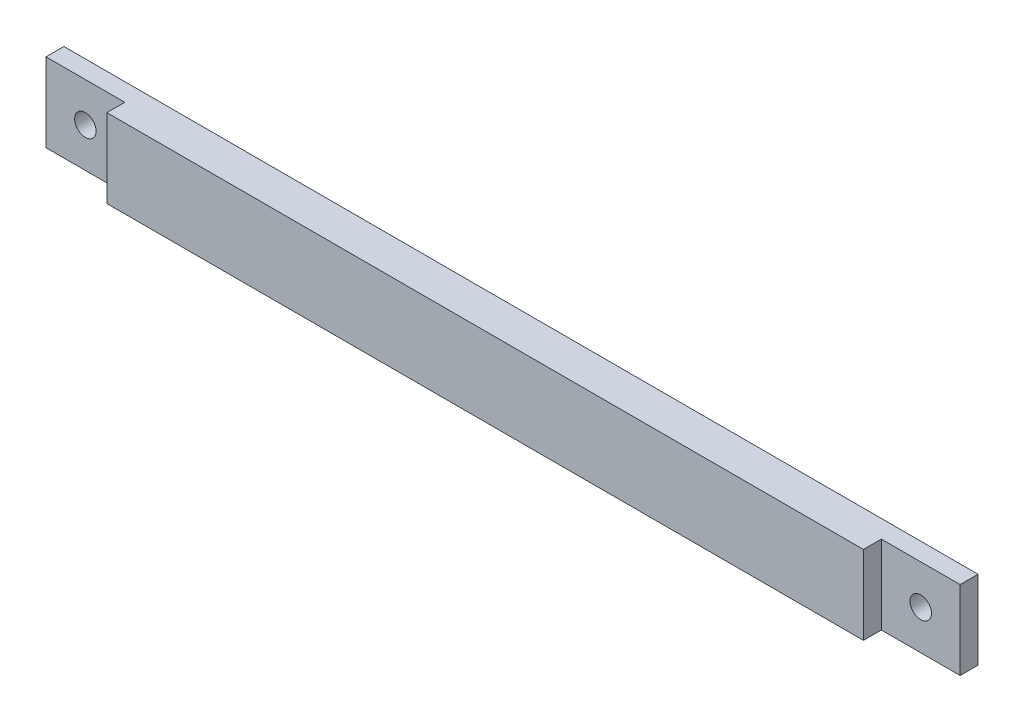
from build123d import *

# Parameters (mm, degrees)
ESQUISSE5_W             = 255.35
ESQUISSE5_H             = 22
BOSS_EXTRU_1_DEPTH      = 10
ESQUISSE6_R             = 3
ENL_V_MAT_EXTRU_4_DEPTH = 173.494473459
ESQUISSE7_W             = 22
ESQUISSE7_H             = 22
ENL_V_MAT_EXTRU_5_DEPTH = 5


with BuildPart() as part:
    # Esquisse5 → Boss.-Extru.1 (new body)
    with BuildSketch(Plane.XY):
        with Locations((41.235968465, 22.517579062)):
            Rectangle(ESQUISSE5_W, ESQUISSE5_H)
    extrude(amount=BOSS_EXTRU_1_DEPTH)

    # Esquisse6 → Enlèv. mat.-Extru.4 (cut, through all)
    with BuildSketch(Plane.XY):
        with Locations((-75.439031535, 22.517579062)):
            Circle(ESQUISSE6_R)
        with Locations((157.910968465, 22.517579062)):
            Circle(ESQUISSE6_R)
    extrude(amount=ENL_V_MAT_EXTRU_4_DEPTH, mode=Mode.SUBTRACT)

    # Esquisse7 → Enlèv. mat.-Extru.5 (cut)
    with BuildSketch(Plane.XY.offset(10)):
        with Locations((-75.439031535, 22.517579062)):
            Rectangle(ESQUISSE7_W, ESQUISSE7_H)
        with Locations((157.910968465, 22.517579062)):
            Rectangle(ESQUISSE7_W, ESQUISSE7_H)
    extrude(amount=-ENL_V_MAT_EXTRU_5_DEPTH, mode=Mode.SUBTRACT)


solid = part.part
